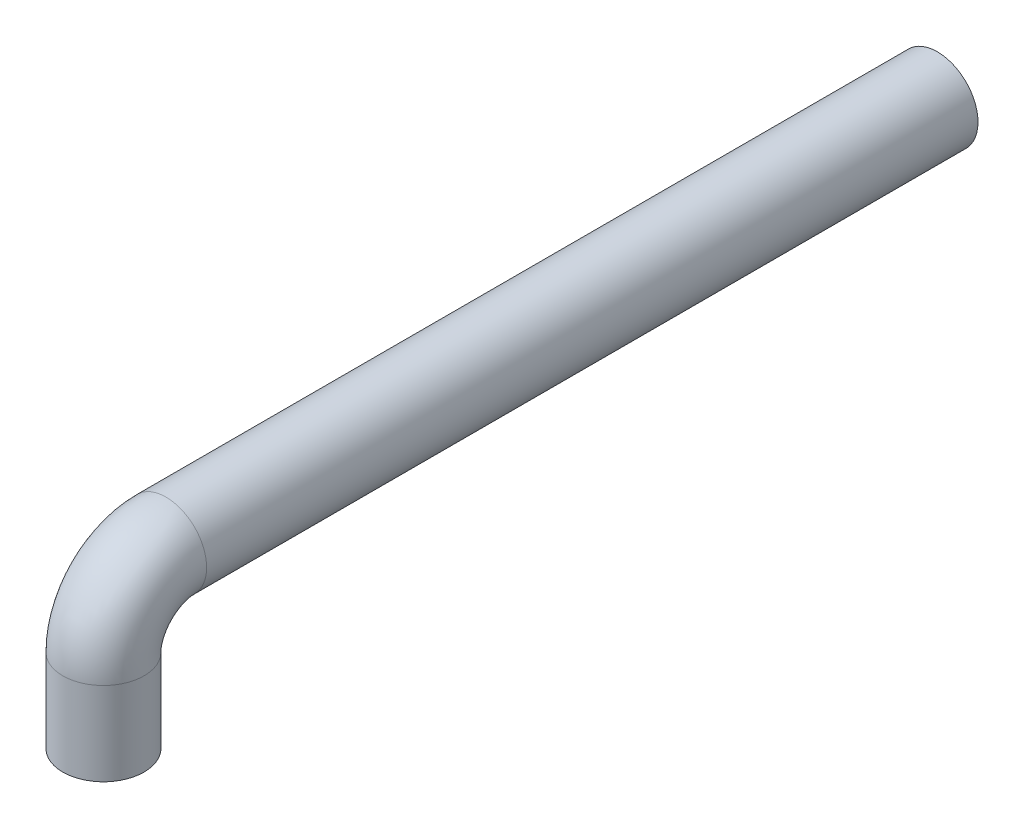
from build123d import *

# Parameters (mm, degrees)
SKETCH2_R = 4.953


with BuildPart() as part:
    # Sweep1: sweep along a path in Sketch4
    with BuildLine(Plane(origin=(0, 0, 0), x_dir=(0, 0, -1), z_dir=(1, 0, 0))) as sweep1_path:
        Line((-101.6, -17.78), (-101.6, -7.62))
        ThreePointArc((-101.6, -7.62), (-99.368153673, -2.231846327), (-93.98, 0))
        Line((-93.98, 0), (0, 0))
    # Sketch2 → Sweep1 (sweep)
    with BuildSketch(Plane.XY):
        Circle(SKETCH2_R)
    sweep(path=sweep1_path.line)


solid = part.part
